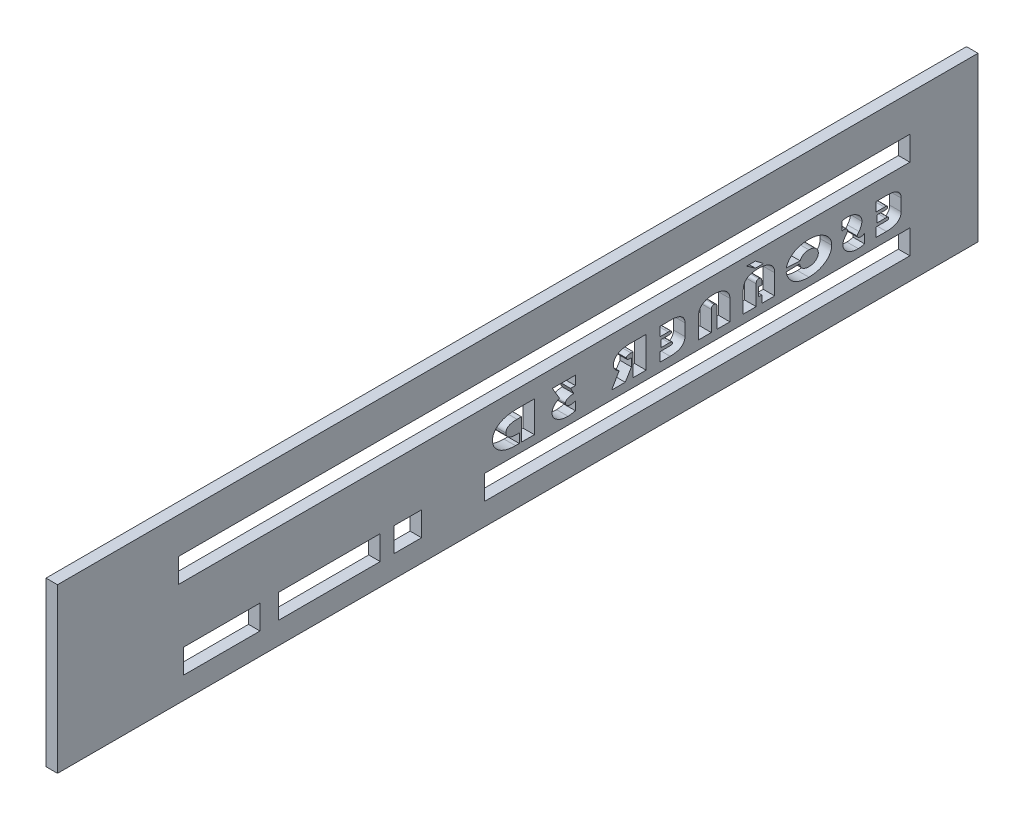
from build123d import *

# Parameters (mm, degrees)
CROQUIS1_W              = 400
CROQUIS1_H              = 71
SALIENTE_EXTRUIR1_DEPTH = 5
CROQUIS2_W              = 12.02046203
CROQUIS2_H              = 10.51923992
CROQUIS2_W_2            = 317.814316247
CROQUIS2_W_3            = 44.192239782
CROQUIS2_W_4            = 33.208558697
CROQUIS2_W_5            = 184.761089321
CORTAR_EXTRUIR1_DEPTH   = 10


with BuildPart() as part:
    # Croquis1 → Saliente-Extruir1 (new body)
    with BuildSketch(Plane(origin=(0, 0, 0), x_dir=(0, 0, -1), z_dir=(1, 0, 0))):
        with Locations((59.75308642, 0)):
            Rectangle(CROQUIS1_W, CROQUIS1_H)
    extrude(amount=SALIENTE_EXTRUIR1_DEPTH)

    # Croquis2 → Cortar-Extruir1 (cut)
    with BuildSketch(Plane(origin=(5, 0, 0), x_dir=(0, 0, -1), z_dir=(1, 0, 0))):
        with Locations((11.933317435, -20.65961996)):
            Rectangle(CROQUIS2_W, CROQUIS2_H)
        with Locations((71.235692244, 14.574525503)):
            Rectangle(CROQUIS2_W_2, CROQUIS2_H)
        with Locations((-22.096119891, -20.65961996)):
            Rectangle(CROQUIS2_W_3, CROQUIS2_H)
        with Locations((-68.854478227, -20.65961996)):
            Rectangle(CROQUIS2_W_4, CROQUIS2_H)
        with Locations((137.762305707, -20.65961996)):
            Rectangle(CROQUIS2_W_5, CROQUIS2_H)
        with BuildLine():
            Line((215.855840659, -3.401664255), (215.855840659, -6.401664255))
            Line((215.855840659, -6.401664255), (219.541387534, -6.401664255))
            add(Edge.make_bspline(
                [(219.541387534, -6.401664255), (219.657673329, -6.402754075), (219.872134465, -6.404763986), (220.166200824, -6.433364173), (220.406325417, -6.478238671), (220.597814798, -6.539963575), (220.744643924, -6.629511988), (220.845477967, -6.749235234), (220.908363541, -6.895113914), (220.914887688, -7.001570842), (220.918340659, -7.057914255)],
                knots=[0, 0, 0, 0, 1.630136716, 3.006394509, 4.137064202, 5.050894287, 5.814465357, 6.514080752, 7.213562109, 8, 8, 8, 8], degree=3))
            add(Edge.make_bspline(
                [(220.918340659, -7.057914255), (220.914908071, -7.120018847), (220.908508946, -7.235795929), (220.848019717, -7.394257007), (220.74421513, -7.519004013), (220.586104232, -7.601138101), (220.372400147, -7.653572255), (220.085292913, -7.687630043), (219.71653488, -7.709747805), (219.44279667, -7.712597957), (219.292364097, -7.714164255)],
                knots=[0, 0, 0, 0, 0.750752499, 1.39957338, 2.021345761, 2.673616694, 3.521257015, 4.68037925, 6.175705575, 8, 8, 8, 8], degree=3))
            Line((219.292364097, -7.714164255), (215.480840659, -7.714164255))
            Line((215.480840659, -7.714164255), (215.480840659, -11.651664255))
            Line((215.480840659, -11.651664255), (219.931035972, -11.651664255))
            add(Edge.make_bspline(
                [(219.931035972, -11.651664255), (220.184042476, -11.648202173), (220.674942092, -11.641484817), (221.388068473, -11.59230836), (222.054124524, -11.50761771), (222.675148107, -11.392033278), (223.251300704, -11.240228636), (223.781955025, -11.054209422), (224.266279681, -10.833300519), (224.704510959, -10.582603021), (225.094596007, -10.29849976), (225.430848412, -9.979271446), (225.718511458, -9.632298878), (225.951435929, -9.252945781), (226.135123312, -8.845739567), (226.264053481, -8.407186373), (226.340852121, -7.938550904), (226.350763198, -7.615825254), (226.355840659, -7.45049238)],
                knots=[0, 0, 0, 0, 1.403479464, 2.72312182, 3.962863154, 5.12629019, 6.224831384, 7.264870769, 8.241819425, 9.17381455, 10.061224736, 10.911944124, 11.739457619, 12.554319661, 13.373904124, 14.210359775, 15.083164408, 16, 16, 16, 16], degree=3))
            Line((226.355840659, -7.45049238), (226.355840659, -2.276664255))
            add(Edge.make_bspline(
                [(226.355840659, -2.276664255), (226.351811969, -2.117192202), (226.343956203, -1.806228892), (226.268890773, -1.353595597), (226.145246503, -0.929011636), (225.975682954, -0.529939965), (225.752800272, -0.160136739), (225.481606327, 0.181104819), (225.161166576, 0.494132434), (224.794336523, 0.777825663), (224.381967137, 1.029556436), (223.92909071, 1.248566579), (223.438283144, 1.436399433), (222.907966138, 1.588612872), (222.337546497, 1.704012287), (221.728067896, 1.788670154), (221.078339756, 1.83815436), (220.632293595, 1.844876097), (220.402715659, 1.848335745)],
                knots=[0, 0, 0, 0, 0.937519619, 1.828120967, 2.689831853, 3.533917632, 4.371350085, 5.221881962, 6.091218756, 7.000159233, 7.944046288, 8.928075012, 9.955484324, 11.031822199, 12.169744694, 13.376208322, 14.649546329, 16, 16, 16, 16], degree=3))
            Line((220.402715659, 1.848335745), (215.480840659, 1.848335745))
            Line((215.480840659, 1.848335745), (215.480840659, -2.089164255))
            Line((215.480840659, -2.089164255), (219.096075034, -2.089164255))
            add(Edge.make_bspline(
                [(219.096075034, -2.089164255), (219.209478981, -2.0899219), (219.421201757, -2.091336409), (219.715843209, -2.12511742), (219.966433189, -2.171031646), (220.173186419, -2.241368743), (220.337478928, -2.329082612), (220.457668337, -2.442092115), (220.529838984, -2.580033947), (220.538808303, -2.680166875), (220.543340659, -2.730765817)],
                knots=[0, 0, 0, 0, 1.560937436, 2.914237275, 4.080289261, 5.063011804, 5.912291937, 6.625747919, 7.305566083, 8, 8, 8, 8], degree=3))
            add(Edge.make_bspline(
                [(220.543340659, -2.730765817), (220.540751475, -2.790329093), (220.535842175, -2.903265842), (220.461303241, -3.053895759), (220.351570541, -3.178968355), (220.187667219, -3.266491979), (219.973070973, -3.330414891), (219.696707789, -3.368330094), (219.355557945, -3.399207835), (219.105946448, -3.400798535), (218.970098472, -3.401664255)],
                knots=[0, 0, 0, 0, 0.740721677, 1.404467702, 2.064351403, 2.800491568, 3.700239067, 4.867468387, 6.295158338, 8, 8, 8, 8], degree=3))
            Line((218.970098472, -3.401664255), (215.855840659, -3.401664255))
        make_face()
        with BuildLine():
            Line((200.668340659, 1.906929495), (200.668340659, -1.863578317))
            add(Edge.make_bspline(
                [(200.668340659, -1.863578317), (200.761929989, -1.841313009), (200.936775902, -1.799716408), (201.183994353, -1.752914009), (201.396956227, -1.720026548), (201.528599374, -1.715992542), (201.588262534, -1.714164255)],
                knots=[0, 0, 0, 0, 1.235918481, 2.308973649, 3.233594919, 4, 4, 4, 4], degree=3))
            add(Edge.make_bspline(
                [(201.588262534, -1.714164255), (201.689256232, -1.717513403), (201.885644539, -1.724026024), (202.168228843, -1.791910359), (202.429931211, -1.89662868), (202.661363319, -2.044957576), (202.855062861, -2.221666906), (203.001514611, -2.420052421), (203.088146633, -2.642145463), (203.099906765, -2.796457942), (203.105840659, -2.874320505)],
                knots=[0, 0, 0, 0, 1.145792027, 2.228061382, 3.283303588, 4.336267092, 5.333721328, 6.248463591, 7.116214617, 8, 8, 8, 8], degree=3))
            add(Edge.make_bspline(
                [(203.105840659, -2.874320505), (203.098178461, -2.948241492), (203.081465681, -3.109477887), (202.981512448, -3.359138813), (202.822345074, -3.631653625), (202.686932746, -3.815090869), (202.613653159, -3.914359567)],
                knots=[0, 0, 0, 0, 0.760632877, 1.659091795, 2.733196679, 4, 4, 4, 4], degree=3))
            Line((202.613653159, -3.914359567), (202.191778159, -4.453422067))
            add(Edge.make_bspline(
                [(202.191778159, -4.453422067), (202.100403854, -4.573409166), (201.92219693, -4.807419498), (201.687157708, -5.168057915), (201.489950604, -5.526786137), (201.327548141, -5.88202701), (201.200630956, -6.234738651), (201.108838433, -6.583469055), (201.053705755, -6.930170594), (201.046783712, -7.160262464), (201.043340659, -7.27471113)],
                knots=[0, 0, 0, 0, 1.166174929, 2.27438605, 3.325643325, 4.329518438, 5.292291421, 6.221076418, 7.115155916, 8, 8, 8, 8], degree=3))
            add(Edge.make_bspline(
                [(201.043340659, -7.27471113), (201.048240929, -7.438295689), (201.057920483, -7.761426009), (201.157324662, -8.234782243), (201.309504949, -8.688715387), (201.521932365, -9.124714138), (201.802255465, -9.535927354), (202.138826114, -9.931094441), (202.537011053, -10.306620251), (202.991420591, -10.657078744), (203.489155496, -10.976145966), (204.017552314, -11.258818426), (204.573430063, -11.496674615), (205.156876906, -11.689942343), (205.765949074, -11.842250788), (206.402509069, -11.950184718), (207.065375943, -12.016004796), (207.516819284, -12.023070152), (207.746465659, -12.026664255)],
                knots=[0, 0, 0, 0, 0.862895045, 1.704485763, 2.542846037, 3.387103593, 4.256861803, 5.164282421, 6.123812978, 7.142095967, 8.190804431, 9.242995114, 10.303571725, 11.380057313, 12.485896787, 13.616207831, 14.787379987, 16, 16, 16, 16], degree=3))
            add(Edge.make_bspline(
                [(207.746465659, -12.026664255), (207.971401124, -12.021319585), (208.42115531, -12.010633018), (209.093500904, -11.914555573), (209.762773595, -11.765113256), (210.198788618, -11.617563415), (210.418340659, -11.543265817)],
                knots=[0, 0, 0, 0, 0.988734236, 1.976955317, 2.98131127, 4, 4, 4, 4], degree=3))
            Line((210.418340659, -11.543265817), (210.418340659, -7.605765817))
            add(Edge.make_bspline(
                [(210.418340659, -7.605765817), (210.287959366, -7.679073343), (210.039843486, -7.818577721), (209.664457218, -7.970720487), (209.311227562, -8.070896342), (209.081028311, -8.083259207), (208.971075034, -8.089164255)],
                knots=[0, 0, 0, 0, 1.162224486, 2.211715691, 3.145836845, 4, 4, 4, 4], degree=3))
            add(Edge.make_bspline(
                [(208.971075034, -8.089164255), (208.851736564, -8.084997861), (208.622421363, -8.076991916), (208.292523673, -8.022411589), (207.994997765, -7.924959871), (207.731858652, -7.795758987), (207.512516305, -7.636465477), (207.349354147, -7.451990588), (207.249511493, -7.2405793), (207.237120398, -7.092131273), (207.230840659, -7.01689863)],
                knots=[0, 0, 0, 0, 1.272270679, 2.444735607, 3.550984775, 4.598604102, 5.558537262, 6.42242629, 7.200494327, 8, 8, 8, 8], degree=3))
            add(Edge.make_bspline(
                [(207.230840659, -7.01689863), (207.233586374, -6.988314184), (207.240010353, -6.921436904), (207.283967603, -6.813553798), (207.344208234, -6.681468905), (207.434236081, -6.530178878), (207.547411712, -6.356572507), (207.680663138, -6.157439089), (207.842565843, -5.938043494), (207.961823722, -5.78704699), (208.024785972, -5.707328317)],
                knots=[0, 0, 0, 0, 0.443987436, 1.038770286, 1.791912179, 2.702396897, 3.766744256, 5.011861415, 6.422410889, 8, 8, 8, 8], degree=3))
            add(Edge.make_bspline(
                [(208.024785972, -5.707328317), (208.125310327, -5.574875486), (208.322001773, -5.315711038), (208.578562875, -4.913181582), (208.801932827, -4.513909667), (208.981064029, -4.111775386), (209.119298876, -3.708547701), (209.219874202, -3.306954543), (209.280766372, -2.904501821), (209.289152121, -2.636241599), (209.293340659, -2.502250192)],
                knots=[0, 0, 0, 0, 1.135703392, 2.222179327, 3.258486084, 4.259143465, 5.225578612, 6.167446175, 7.084670609, 8, 8, 8, 8], degree=3))
            add(Edge.make_bspline(
                [(209.293340659, -2.502250192), (209.287780078, -2.343645035), (209.27674346, -2.028846219), (209.186202348, -1.566624314), (209.037945775, -1.121847033), (208.831143691, -0.694547941), (208.56390998, -0.283743036), (208.237313796, 0.108229494), (207.851802921, 0.482164928), (207.415861845, 0.835028084), (206.939847617, 1.161422238), (206.432125142, 1.444998637), (205.903055544, 1.686211067), (205.351561069, 1.883956733), (204.776986596, 2.035754297), (204.179261729, 2.142619951), (203.559703389, 2.213679626), (203.138269175, 2.220083084), (202.924200034, 2.223335745)],
                knots=[0, 0, 0, 0, 0.868592718, 1.723978994, 2.57012504, 3.431782609, 4.317952458, 5.249128397, 6.221703252, 7.25641221, 8.319193202, 9.380599018, 10.439113855, 11.50213734, 12.587317582, 13.69156897, 14.827423522, 16, 16, 16, 16], degree=3))
            add(Edge.make_bspline(
                [(202.924200034, 2.223335745), (202.733626462, 2.219132482), (202.352574444, 2.210728052), (201.784629554, 2.150867022), (201.221597758, 2.051902761), (200.853302839, 1.955396241), (200.668340659, 1.906929495)],
                knots=[0, 0, 0, 0, 1.000793928, 2.001088306, 2.996122278, 4, 4, 4, 4], degree=3))
        make_face()
        with BuildLine():
            Line((182.264043784, -5.004203317), (176.390020347, -5.112601755))
            add(Edge.make_bspline(
                [(176.390020347, -5.112601755), (176.443265565, -5.381517776), (176.547900464, -5.909978384), (176.794153814, -6.668190725), (177.08962221, -7.38404875), (177.455891439, -8.050567069), (177.885816164, -8.668505043), (178.377750962, -9.239828183), (178.931861955, -9.763375319), (179.545192834, -10.238170401), (180.214758408, -10.660021851), (180.935852294, -11.026685768), (181.705961188, -11.338515796), (182.526621232, -11.587590927), (183.393374813, -11.788644984), (184.310133101, -11.927241694), (185.275232467, -12.009189065), (185.934779696, -12.020753823), (186.271856284, -12.026664255)],
                knots=[0, 0, 0, 0, 0.992752036, 1.950907732, 2.883657513, 3.796033148, 4.701268786, 5.607258288, 6.523579586, 7.459493467, 8.41392897, 9.387402432, 10.387721803, 11.42103917, 12.492517806, 13.609777017, 14.778422268, 16, 16, 16, 16], degree=3))
            add(Edge.make_bspline(
                [(186.271856284, -12.026664255), (186.615802522, -12.02033671), (187.291330284, -12.007909092), (188.28350772, -11.914305683), (189.232856015, -11.752366932), (190.140031823, -11.530618435), (191.004975857, -11.246863272), (191.825696269, -10.897510358), (192.602732968, -10.482292531), (193.212599024, -10.085256334), (193.671478008, -9.740419141), (193.993143793, -9.474530048), (194.29370926, -9.201150841), (194.571222855, -8.920354802), (194.829184215, -8.632969201), (195.057849248, -8.33333619), (195.2723322, -8.030464559), (195.46160535, -7.717862132), (195.629029776, -7.397970239), (195.774703482, -7.070728174), (195.892427328, -6.734719718), (195.993998356, -6.391897116), (196.072774757, -6.041602667), (196.128647994, -5.682442345), (196.160874735, -5.316320926), (196.16584166, -5.069694313), (196.168340659, -4.945609567)],
                knots=[0, 0, 0, 0, 1.834350375, 3.602756677, 5.309376519, 6.96682563, 8.57937272, 10.159260752, 11.718188301, 13.272689149, 14.035240609, 14.778842387, 15.497810052, 16.201290444, 16.883866045, 17.555866511, 18.210442383, 18.862547482, 19.503236293, 20.135227566, 20.771155985, 21.400781772, 22.041449409, 22.684568482, 23.338169618, 24, 24, 24, 24], degree=3))
            add(Edge.make_bspline(
                [(196.168340659, -4.945609567), (196.165762756, -4.820559868), (196.160638819, -4.572006459), (196.129555067, -4.202646754), (196.069486088, -3.841964218), (195.989777709, -3.489025811), (195.89229205, -3.142145443), (195.76342691, -2.805126421), (195.618334176, -2.473283647), (195.447748259, -2.150305639), (195.25280425, -1.836634812), (195.03853893, -1.527969956), (194.802686527, -1.225927904), (194.537977005, -0.936649843), (194.259582284, -0.647970758), (193.951810948, -0.37299692), (193.623464075, -0.103147491), (193.156316034, 0.247369048), (192.533883029, 0.649808276), (191.745195127, 1.073810354), (190.910594253, 1.427861974), (190.036542997, 1.722317529), (189.118832055, 1.946726266), (188.161168397, 2.10669933), (187.161640768, 2.205771409), (186.481073266, 2.217405425), (186.134160972, 2.223335745)],
                knots=[0, 0, 0, 0, 0.658901174, 1.309656348, 1.950821784, 2.583675695, 3.215503928, 3.847206453, 4.482981758, 5.122803918, 5.76964204, 6.427618496, 7.101810357, 7.786753817, 8.492596906, 9.213873327, 9.959618948, 10.731392011, 12.289796147, 13.859675221, 15.443262943, 17.060544451, 18.713997068, 20.415021004, 22.172593778, 24, 24, 24, 24], degree=3))
            add(Edge.make_bspline(
                [(186.134160972, 2.223335745), (185.793114818, 2.217204213), (185.124348819, 2.205180736), (184.143572256, 2.109172438), (183.205130485, 1.955826597), (182.309404367, 1.736572683), (181.456979698, 1.451971379), (180.648855719, 1.104831666), (179.880206317, 0.699503216), (179.404756935, 0.375397006), (179.167364097, 0.21357012)],
                knots=[0, 0, 0, 0, 1.110237194, 2.177092093, 3.205293721, 4.203966652, 5.176269235, 6.127761153, 7.06518736, 8, 8, 8, 8], degree=3))
            add(Edge.make_bspline(
                [(179.167364097, 0.21357012), (179.009880593, 0.095180153), (178.695986315, -0.140793346), (178.265104069, -0.542672426), (177.869109536, -0.977289389), (177.506183939, -1.444107212), (177.184292319, -1.948967936), (176.893582007, -2.484625392), (176.640166628, -3.056338011), (176.501498373, -3.454318604), (176.431035972, -3.656547067)],
                knots=[0, 0, 0, 0, 0.979964789, 1.953254354, 2.926835098, 3.903818604, 4.891992314, 5.90319124, 6.93453495, 8, 8, 8, 8], degree=3))
            Line((176.431035972, -3.656547067), (182.442754722, -3.94658613))
            add(Edge.make_bspline(
                [(182.442754722, -3.94658613), (182.485520793, -3.856149717), (182.570187971, -3.677106014), (182.715899435, -3.422640989), (182.878394074, -3.187941678), (183.052113694, -2.968291871), (183.241349546, -2.767417125), (183.446045556, -2.58431347), (183.662683748, -2.416726592), (183.893732858, -2.267289208), (184.140435162, -2.13745657), (184.399957686, -2.024158549), (184.673437265, -1.9257753), (184.962395004, -1.851655351), (185.263326008, -1.789341773), (185.579413734, -1.74572202), (185.909085829, -1.719053252), (186.134109537, -1.715811185), (186.248418784, -1.714164255)],
                knots=[0, 0, 0, 0, 1.021460263, 2.022260972, 2.990527933, 3.934449091, 4.879897076, 5.80508482, 6.736701277, 7.6745433, 8.611483323, 9.580623128, 10.564836631, 11.576069066, 12.624489731, 13.702106345, 14.832698578, 16, 16, 16, 16], degree=3))
            add(Edge.make_bspline(
                [(186.248418784, -1.714164255), (186.393995814, -1.717266784), (186.679876712, -1.723359463), (187.098647036, -1.762564805), (187.496622825, -1.838021017), (187.876512531, -1.936120976), (188.236637927, -2.066001677), (188.579783077, -2.220068884), (188.898891256, -2.409580718), (189.197609119, -2.622388448), (189.468367461, -2.857023319), (189.704774612, -3.110701901), (189.90538798, -3.378707365), (190.072294648, -3.661578817), (190.197919226, -3.962828779), (190.288726657, -4.278317592), (190.34712754, -4.609469611), (190.3528985, -4.835986027), (190.355840659, -4.951468942)],
                knots=[0, 0, 0, 0, 1.196957228, 2.350557687, 3.452867449, 4.523946135, 5.572766527, 6.596707709, 7.611543077, 8.61859937, 9.608775799, 10.551803759, 11.463871259, 12.356183022, 13.244911698, 14.139315975, 15.051383475, 16, 16, 16, 16], degree=3))
            add(Edge.make_bspline(
                [(190.355840659, -4.951468942), (190.352581172, -5.063001604), (190.346195483, -5.281506212), (190.292249277, -5.602539301), (190.200775567, -5.906752889), (190.076717245, -6.198657108), (189.915183535, -6.474256057), (189.71529615, -6.733796218), (189.484170137, -6.98083885), (189.217077066, -7.207115578), (188.925417443, -7.414668325), (188.611110058, -7.597244614), (188.276187637, -7.749431744), (187.922713942, -7.8721218), (187.551465491, -7.96911634), (187.161749989, -8.039314402), (186.752231818, -8.080427848), (186.47312169, -8.086209083), (186.330450034, -8.089164255)],
                knots=[0, 0, 0, 0, 0.939860965, 1.841289795, 2.734750413, 3.612559575, 4.509200856, 5.419794395, 6.369163099, 7.355921635, 8.365631112, 9.383763894, 10.415355745, 11.462080506, 12.534426685, 13.647100621, 14.797277433, 16, 16, 16, 16], degree=3))
            add(Edge.make_bspline(
                [(186.330450034, -8.089164255), (186.186794365, -8.087314013), (185.905786039, -8.083694712), (185.495904689, -8.043825777), (185.107641294, -7.984563786), (184.742813304, -7.895133735), (184.398709468, -7.785721433), (184.07867079, -7.646840386), (183.78016779, -7.486150905), (183.50708505, -7.297376454), (183.257618057, -7.086600662), (183.033645843, -6.853997616), (182.835731315, -6.600109845), (182.664152918, -6.323802688), (182.526175826, -6.022985867), (182.406047703, -5.704988018), (182.318514254, -5.362863837), (182.282491487, -5.125672115), (182.264043784, -5.004203317)],
                knots=[0, 0, 0, 0, 1.217538849, 2.381657159, 3.488296945, 4.544575858, 5.563090521, 6.545879474, 7.498059416, 8.432764682, 9.355066706, 10.262684078, 11.165302853, 12.079804906, 13.013152414, 13.966699243, 14.958721679, 16, 16, 16, 16], degree=3))
        make_face()
        with BuildLine():
            Line((164.293340659, -4.714164255), (164.293340659, -8.464164255))
            Line((164.293340659, -8.464164255), (165.793340659, -8.464164255))
            Line((165.793340659, -8.464164255), (165.793340659, -11.651664255))
            Line((165.793340659, -11.651664255), (171.418340659, -11.651664255))
            Line((171.418340659, -11.651664255), (171.418340659, -2.953422067))
            add(Edge.make_bspline(
                [(171.418340659, -2.953422067), (171.412989491, -2.753867939), (171.402546932, -2.364447294), (171.312950198, -1.796936869), (171.164717121, -1.264331246), (170.953609922, -0.767430629), (170.688530178, -0.302509678), (170.361772642, 0.128219237), (169.969520936, 0.51802573), (169.526001071, 0.877295427), (169.027238171, 1.195371404), (168.477922195, 1.471245782), (167.881733605, 1.705600849), (167.237063907, 1.894238209), (166.546034547, 2.044466854), (165.806539275, 2.146623357), (165.020154523, 2.213315646), (164.48000912, 2.219935123), (164.202520347, 2.223335745)],
                knots=[0, 0, 0, 0, 0.955562247, 1.864735494, 2.744519502, 3.597818857, 4.444474242, 5.302531524, 6.179212579, 7.087434361, 8.032227191, 9.007245044, 10.028072126, 11.096843119, 12.221886398, 13.412840862, 14.670899338, 16, 16, 16, 16], degree=3))
            add(Edge.make_bspline(
                [(164.202520347, 2.223335745), (163.935830445, 2.219106258), (163.420399996, 2.210931946), (162.673694823, 2.156672303), (161.980784092, 2.060577098), (161.341031382, 1.927306352), (160.753634512, 1.756260562), (160.22199132, 1.541016457), (159.7393642, 1.294522479), (159.314145817, 1.000696629), (158.936399239, 0.670989771), (158.612414613, 0.295427276), (158.337887586, -0.121189062), (158.113817426, -0.580008608), (157.941345054, -1.081087508), (157.820772208, -1.623644725), (157.741381933, -2.206943339), (157.734429915, -2.610370931), (157.730840659, -2.818656442)],
                knots=[0, 0, 0, 0, 1.360932961, 2.630269395, 3.817809215, 4.928126888, 5.962504934, 6.935110729, 7.851228201, 8.722080596, 9.565935801, 10.403231988, 11.244980296, 12.10527408, 13.002034629, 13.942576911, 14.937773642, 16, 16, 16, 16], degree=3))
            Line((157.730840659, -2.818656442), (157.730840659, -11.651664255))
            Line((157.730840659, -11.651664255), (163.355840659, -11.651664255))
            Line((163.355840659, -11.651664255), (163.355840659, -3.07939863))
            add(Edge.make_bspline(
                [(163.355840659, -3.07939863), (163.357622103, -2.961018754), (163.360924677, -2.741557345), (163.409471873, -2.442623263), (163.486051895, -2.19960463), (163.599978695, -2.008030201), (163.763804706, -1.868431983), (163.974822519, -1.775259656), (164.233076695, -1.72176008), (164.420993912, -1.716817257), (164.521856284, -1.714164255)],
                knots=[0, 0, 0, 0, 1.349596285, 2.50198187, 3.442922759, 4.243831801, 5.010191558, 5.857808669, 6.850203806, 8, 8, 8, 8], degree=3))
            add(Edge.make_bspline(
                [(164.521856284, -1.714164255), (164.621824999, -1.717373336), (164.810487007, -1.723429547), (165.074559878, -1.787450895), (165.296565746, -1.898289266), (165.483752799, -2.048416632), (165.625386653, -2.24759339), (165.725598678, -2.488678713), (165.782476327, -2.771130473), (165.789579857, -2.972688379), (165.793340659, -3.07939863)],
                knots=[0, 0, 0, 0, 1.121363497, 2.11624895, 3.023677973, 3.888757511, 4.783839986, 5.737232887, 6.802029397, 8, 8, 8, 8], degree=3))
            Line((165.793340659, -3.07939863), (165.793340659, -4.714164255))
            Line((165.793340659, -4.714164255), (164.293340659, -4.714164255))
        make_face()
        Polygon((159.189825034, 5.67450762), (163.048223472, 2.973335745), (166.490606284, 2.973335745), (163.048223472, 5.67450762), align=None)
        with BuildLine():
            Line((151.918340659, -11.651664255), (151.918340659, -2.82158613))
            add(Edge.make_bspline(
                [(151.918340659, -2.82158613), (151.913176875, -2.634682021), (151.903055198, -2.268326152), (151.809778061, -1.733790234), (151.656903211, -1.229190754), (151.444204371, -0.7521598), (151.169364561, -0.305007315), (150.835365917, 0.114519393), (150.439007733, 0.502805934), (149.984641529, 0.85801957), (149.481014254, 1.178940568), (148.935665953, 1.461647498), (148.347216103, 1.693977785), (147.722750725, 1.892956971), (147.055319167, 2.038916854), (146.350004915, 2.147763521), (145.604139389, 2.212862945), (145.093275681, 2.219786829), (144.831426597, 2.223335745)],
                knots=[0, 0, 0, 0, 0.920413059, 1.804126881, 2.664241702, 3.512972747, 4.370498886, 5.243813309, 6.148991121, 7.09823984, 8.080755947, 9.088038995, 10.120179025, 11.194718592, 12.314347231, 13.482949882, 14.709856936, 16, 16, 16, 16], degree=3))
            add(Edge.make_bspline(
                [(144.831426597, 2.223335745), (144.57247231, 2.220036327), (144.069336018, 2.213625709), (143.337805942, 2.145819911), (142.651800091, 2.047379656), (142.012494652, 1.901433107), (141.42228158, 1.710009002), (140.87581084, 1.483294086), (140.378264261, 1.209450769), (139.927959581, 0.895646177), (139.526541726, 0.54304636), (139.178306116, 0.15190203), (138.88609258, -0.278454173), (138.643777481, -0.74273226), (138.460010734, -1.246723165), (138.324699205, -1.78439876), (138.245079636, -2.360225097), (138.235674708, -2.755905347), (138.230840659, -2.959281442)],
                knots=[0, 0, 0, 0, 1.303555738, 2.532748956, 3.696212003, 4.791239296, 5.830025681, 6.817289634, 7.765843729, 8.683930017, 9.575804656, 10.450114009, 11.313471885, 12.188817747, 13.0803263, 14.008197646, 14.976231478, 16, 16, 16, 16], degree=3))
            Line((138.230840659, -2.959281442), (138.230840659, -11.651664255))
            Line((138.230840659, -11.651664255), (143.855840659, -11.651664255))
            Line((143.855840659, -11.651664255), (143.855840659, -2.959281442))
            add(Edge.make_bspline(
                [(143.855840659, -2.959281442), (143.859785643, -2.861355523), (143.867196644, -2.677393024), (143.921388343, -2.419240844), (144.018510885, -2.198902997), (144.158970367, -2.019241939), (144.338877508, -1.879004931), (144.558388696, -1.783450228), (144.81471833, -1.724655538), (144.998069276, -1.7177949), (145.095098472, -1.714164255)],
                knots=[0, 0, 0, 0, 1.167136709, 2.192569502, 3.125308558, 4.012691332, 4.883731052, 5.816470108, 6.844477461, 8, 8, 8, 8], degree=3))
            add(Edge.make_bspline(
                [(145.095098472, -1.714164255), (145.189178483, -1.717818746), (145.366705089, -1.724714678), (145.614844561, -1.783013017), (145.825914039, -1.881015655), (146.002540999, -2.017516968), (146.133193284, -2.20128314), (146.226545684, -2.420022419), (146.28678336, -2.676827459), (146.291064898, -2.861253589), (146.293340659, -2.959281442)],
                knots=[0, 0, 0, 0, 1.13973307, 2.15064754, 3.066989544, 3.94352748, 4.824532694, 5.768310729, 6.813792231, 8, 8, 8, 8], degree=3))
            Line((146.293340659, -2.959281442), (146.293340659, -11.651664255))
            Line((146.293340659, -11.651664255), (151.918340659, -11.651664255))
        make_face()
        with BuildLine():
            Line((121.918340659, -3.401664255), (121.918340659, -6.401664255))
            Line((121.918340659, -6.401664255), (125.603887534, -6.401664255))
            add(Edge.make_bspline(
                [(125.603887534, -6.401664255), (125.720173329, -6.402754075), (125.934634465, -6.404763986), (126.228700824, -6.433364173), (126.468825417, -6.478238671), (126.660314798, -6.539963575), (126.807143924, -6.629511988), (126.907977967, -6.749235234), (126.970863541, -6.895113914), (126.977387688, -7.001570842), (126.980840659, -7.057914255)],
                knots=[0, 0, 0, 0, 1.630136716, 3.006394509, 4.137064202, 5.050894287, 5.814465357, 6.514080752, 7.213562109, 8, 8, 8, 8], degree=3))
            add(Edge.make_bspline(
                [(126.980840659, -7.057914255), (126.977408071, -7.120018847), (126.971008946, -7.235795929), (126.910519717, -7.394257007), (126.80671513, -7.519004013), (126.648604232, -7.601138101), (126.434900147, -7.653572255), (126.147792913, -7.687630043), (125.77903488, -7.709747805), (125.50529667, -7.712597957), (125.354864097, -7.714164255)],
                knots=[0, 0, 0, 0, 0.750752499, 1.39957338, 2.021345761, 2.673616694, 3.521257015, 4.68037925, 6.175705575, 8, 8, 8, 8], degree=3))
            Line((125.354864097, -7.714164255), (121.543340659, -7.714164255))
            Line((121.543340659, -7.714164255), (121.543340659, -11.651664255))
            Line((121.543340659, -11.651664255), (125.993535972, -11.651664255))
            add(Edge.make_bspline(
                [(125.993535972, -11.651664255), (126.246542476, -11.648202173), (126.737442092, -11.641484817), (127.450568473, -11.59230836), (128.116624524, -11.50761771), (128.737648107, -11.392033278), (129.313800704, -11.240228636), (129.844455025, -11.054209422), (130.328779681, -10.833300519), (130.767010959, -10.582603021), (131.157096007, -10.29849976), (131.493348412, -9.979271446), (131.781011458, -9.632298878), (132.013935929, -9.252945781), (132.197623312, -8.845739567), (132.326553481, -8.407186373), (132.403352121, -7.938550904), (132.413263198, -7.615825254), (132.418340659, -7.45049238)],
                knots=[0, 0, 0, 0, 1.403479464, 2.72312182, 3.962863154, 5.12629019, 6.224831384, 7.264870769, 8.241819425, 9.17381455, 10.061224736, 10.911944124, 11.739457619, 12.554319661, 13.373904124, 14.210359775, 15.083164408, 16, 16, 16, 16], degree=3))
            Line((132.418340659, -7.45049238), (132.418340659, -2.276664255))
            add(Edge.make_bspline(
                [(132.418340659, -2.276664255), (132.414311969, -2.117192202), (132.406456203, -1.806228892), (132.331390773, -1.353595597), (132.207746503, -0.929011636), (132.038182954, -0.529939965), (131.815300272, -0.160136739), (131.544106327, 0.181104819), (131.223666576, 0.494132434), (130.856836523, 0.777825663), (130.444467137, 1.029556436), (129.99159071, 1.248566579), (129.500783144, 1.436399433), (128.970466138, 1.588612872), (128.400046497, 1.704012287), (127.790567896, 1.788670154), (127.140839756, 1.83815436), (126.694793595, 1.844876097), (126.465215659, 1.848335745)],
                knots=[0, 0, 0, 0, 0.937519619, 1.828120967, 2.689831853, 3.533917632, 4.371350085, 5.221881962, 6.091218756, 7.000159233, 7.944046288, 8.928075012, 9.955484324, 11.031822199, 12.169744694, 13.376208322, 14.649546329, 16, 16, 16, 16], degree=3))
            Line((126.465215659, 1.848335745), (121.543340659, 1.848335745))
            Line((121.543340659, 1.848335745), (121.543340659, -2.089164255))
            Line((121.543340659, -2.089164255), (125.158575034, -2.089164255))
            add(Edge.make_bspline(
                [(125.158575034, -2.089164255), (125.271978981, -2.0899219), (125.483701757, -2.091336409), (125.778343209, -2.12511742), (126.028933189, -2.171031646), (126.235686419, -2.241368743), (126.399978928, -2.329082612), (126.520168337, -2.442092115), (126.592338984, -2.580033947), (126.601308303, -2.680166875), (126.605840659, -2.730765817)],
                knots=[0, 0, 0, 0, 1.560937436, 2.914237275, 4.080289261, 5.063011804, 5.912291937, 6.625747919, 7.305566083, 8, 8, 8, 8], degree=3))
            add(Edge.make_bspline(
                [(126.605840659, -2.730765817), (126.603251475, -2.790329093), (126.598342175, -2.903265842), (126.523803241, -3.053895759), (126.414070541, -3.178968355), (126.250167219, -3.266491979), (126.035570973, -3.330414891), (125.759207789, -3.368330094), (125.418057945, -3.399207835), (125.168446448, -3.400798535), (125.032598472, -3.401664255)],
                knots=[0, 0, 0, 0, 0.740721677, 1.404467702, 2.064351403, 2.800491568, 3.700239067, 4.867468387, 6.295158338, 8, 8, 8, 8], degree=3))
            Line((125.032598472, -3.401664255), (121.918340659, -3.401664255))
        make_face()
        with BuildLine():
            Line((109.918340659, -1.901664255), (109.918340659, -11.651664255))
            Line((109.918340659, -11.651664255), (115.543340659, -11.651664255))
            Line((115.543340659, -11.651664255), (115.543340659, 1.848335745))
            Line((115.543340659, 1.848335745), (108.406621909, 1.848335745))
            add(Edge.make_bspline(
                [(108.406621909, 1.848335745), (108.139912463, 1.84544196), (107.621500459, 1.839817213), (106.867541711, 1.782616592), (106.160220996, 1.693262741), (105.498072024, 1.568691877), (104.882124232, 1.404983438), (104.311179781, 1.206526344), (103.785839057, 0.971554272), (103.465475063, 0.779214665), (103.308965659, 0.685249808)],
                knots=[0, 0, 0, 0, 1.20819234, 2.348403551, 3.423504133, 4.437043572, 5.398667195, 6.3082313, 7.173509774, 8, 8, 8, 8], degree=3))
            add(Edge.make_bspline(
                [(103.308965659, 0.685249808), (103.149348372, 0.577145096), (102.839479498, 0.367278822), (102.426977754, 0.008050664), (102.078515376, -0.374897127), (101.790421613, -0.777824477), (101.567819947, -1.204962965), (101.408502095, -1.653295879), (101.311781852, -2.125086074), (101.299551725, -2.44710926), (101.293340659, -2.61064863)],
                knots=[0, 0, 0, 0, 1.143930929, 2.22074059, 3.238803518, 4.212189769, 5.153669698, 6.089040419, 7.029519799, 8, 8, 8, 8], degree=3))
            add(Edge.make_bspline(
                [(101.293340659, -2.61064863), (101.300183593, -2.778362745), (101.313723529, -3.110214362), (101.437392384, -3.596257846), (101.636026412, -4.060040856), (101.912605179, -4.504534458), (102.270402481, -4.924510089), (102.700799321, -5.327635802), (103.21279511, -5.706761813), (103.591894354, -5.930557295), (103.789434409, -6.047172067)],
                knots=[0, 0, 0, 0, 0.900224031, 1.781250193, 2.677301668, 3.603758406, 4.583695618, 5.634674607, 6.76748235, 8, 8, 8, 8], degree=3))
            Line((103.789434409, -6.047172067), (100.555059409, -11.651664255))
            Line((100.555059409, -11.651664255), (106.443731284, -11.651664255))
            Line((106.443731284, -11.651664255), (109.168340659, -7.271781442))
            Line((109.168340659, -7.271781442), (109.168340659, -3.776664255))
            Line((109.168340659, -3.776664255), (108.725957847, -3.776664255))
            add(Edge.make_bspline(
                [(108.725957847, -3.776664255), (108.584223628, -3.774483966), (108.319381038, -3.770409909), (107.94963115, -3.724961769), (107.636221745, -3.647236889), (107.375321939, -3.542199759), (107.171633938, -3.399166781), (107.023530248, -3.223537709), (106.933708988, -3.011909594), (106.923588766, -2.859570133), (106.918340659, -2.780570505)],
                knots=[0, 0, 0, 0, 1.472570212, 2.751624222, 3.861837232, 4.821392814, 5.657921365, 6.422047197, 7.181711139, 8, 8, 8, 8], degree=3))
            add(Edge.make_bspline(
                [(106.918340659, -2.780570505), (106.924164959, -2.71093052), (106.935689865, -2.573129514), (107.042749243, -2.38346466), (107.215318002, -2.228924008), (107.452178659, -2.107878659), (107.748880442, -2.012818454), (108.109471719, -1.949456451), (108.533633026, -1.909047666), (108.838151293, -1.904240505), (109.001348472, -1.901664255)],
                knots=[0, 0, 0, 0, 0.66972182, 1.325220583, 2.047500869, 2.88479652, 3.880077099, 5.053468571, 6.420897303, 8, 8, 8, 8], degree=3))
            Line((109.001348472, -1.901664255), (109.918340659, -1.901664255))
        make_face()
        with BuildLine():
            Line((84.793340659, 1.848335745), (74.797246909, 1.848335745))
            Line((74.797246909, 1.848335745), (77.882207847, -3.378226755))
            add(Edge.make_bspline(
                [(77.882207847, -3.378226755), (77.745873317, -3.444437528), (77.480176032, -3.573473239), (77.101694139, -3.781592589), (76.753115422, -3.996783476), (76.429548502, -4.210766804), (76.13938258, -4.435874425), (75.87390401, -4.660121818), (75.638500615, -4.891958836), (75.432395651, -5.130492074), (75.251234823, -5.37579762), (75.095186772, -5.63162936), (74.964002933, -5.898697147), (74.852675669, -6.175973717), (74.773724272, -6.466686883), (74.710047434, -6.765567239), (74.674947465, -7.076605488), (74.670572594, -7.287325123), (74.668340659, -7.394828317)],
                knots=[0, 0, 0, 0, 1.32951903, 2.591050102, 3.787113503, 4.922930344, 5.992207261, 7.006963288, 7.970213243, 8.887403723, 9.769885962, 10.642666624, 11.512414448, 12.377889964, 13.259331908, 14.151533636, 15.056964777, 16, 16, 16, 16], degree=3))
            add(Edge.make_bspline(
                [(74.668340659, -7.394828317), (74.674597144, -7.55447942), (74.686989757, -7.8707104), (74.78422933, -8.334130735), (74.940326227, -8.779226284), (75.162802458, -9.203403779), (75.448149102, -9.607374717), (75.793274707, -9.993681155), (76.204990419, -10.3562328), (76.669666319, -10.698321412), (77.180312026, -11.010047939), (77.725192687, -11.28264685), (78.300481017, -11.510597567), (78.901823652, -11.702487257), (79.533849328, -11.848866508), (80.195178446, -11.948436758), (80.884697854, -12.016537924), (81.354693051, -12.023246643), (81.594121909, -12.026664255)],
                knots=[0, 0, 0, 0, 0.832256108, 1.648502011, 2.458940759, 3.28605147, 4.138258985, 5.033026665, 5.981944626, 6.994720039, 8.039655831, 9.099033112, 10.168940805, 11.264506873, 12.389004719, 13.549002302, 14.751392385, 16, 16, 16, 16], degree=3))
            add(Edge.make_bspline(
                [(81.594121909, -12.026664255), (81.862975672, -12.021468509), (82.400265701, -12.011085087), (83.203322715, -11.913075061), (84.00493865, -11.772709718), (84.529722761, -11.625835215), (84.793340659, -11.55205488)],
                knots=[0, 0, 0, 0, 0.993773571, 1.986003938, 2.988297478, 4, 4, 4, 4], degree=3))
            Line((84.793340659, -11.55205488), (84.793340659, -7.749320505))
            add(Edge.make_bspline(
                [(84.793340659, -7.749320505), (84.603252017, -7.830070562), (84.241876021, -7.983583848), (83.705018792, -8.147162332), (83.207912198, -8.256271166), (82.886605802, -8.270090722), (82.733770347, -8.276664255)],
                knots=[0, 0, 0, 0, 1.157110786, 2.199774043, 3.14368853, 4, 4, 4, 4], degree=3))
            add(Edge.make_bspline(
                [(82.733770347, -8.276664255), (82.581006786, -8.270275921), (82.284357396, -8.257870505), (81.857517017, -8.167706896), (81.470952107, -8.009704839), (81.182805147, -7.830370031), (80.978760592, -7.663194095), (80.846650065, -7.52813682), (80.733841225, -7.385698851), (80.63931088, -7.23744338), (80.56774862, -7.079428205), (80.519525819, -6.914510765), (80.483939076, -6.743014829), (80.481885093, -6.625488114), (80.480840659, -6.565726755)],
                knots=[0, 0, 0, 0, 1.750525936, 3.39932147, 4.970766713, 6.51441864, 7.269712202, 7.990022416, 8.675300352, 9.349239933, 10.000487771, 10.655572153, 11.316369589, 12, 12, 12, 12], degree=3))
            add(Edge.make_bspline(
                [(80.480840659, -6.565726755), (80.48332845, -6.498046688), (80.488258389, -6.363928235), (80.537658384, -6.169256646), (80.614419663, -5.98381231), (80.724647713, -5.810714865), (80.863966024, -5.647147559), (81.037002735, -5.498721913), (81.23703841, -5.356534385), (81.469277274, -5.230063707), (81.72440447, -5.113282354), (82.00355639, -5.014501661), (82.301226817, -4.925785471), (82.621514898, -4.856119253), (82.962190517, -4.804429234), (83.32390541, -4.766550238), (83.706119319, -4.743061036), (83.96811165, -4.739447506), (84.101934409, -4.737601755)],
                knots=[0, 0, 0, 0, 0.727687647, 1.442024908, 2.149201493, 2.881738424, 3.642722404, 4.455111114, 5.330624105, 6.281788651, 7.298564145, 8.350005047, 9.46834729, 10.642339966, 11.87710199, 13.178098056, 14.558603967, 16, 16, 16, 16], degree=3))
            Line((84.101934409, -4.737601755), (82.704473472, -2.089164255))
            Line((82.704473472, -2.089164255), (84.793340659, -2.089164255))
            Line((84.793340659, -2.089164255), (84.793340659, 1.848335745))
        make_face()
        with BuildLine():
            Line((61.355840659, -2.089164255), (61.355840659, -11.651664255))
            Line((61.355840659, -11.651664255), (66.980840659, -11.651664255))
            Line((66.980840659, -11.651664255), (66.980840659, 1.848335745))
            Line((66.980840659, 1.848335745), (59.630254722, 1.848335745))
            add(Edge.make_bspline(
                [(59.630254722, 1.848335745), (59.237565051, 1.844272045), (58.473921908, 1.836369579), (57.361058588, 1.762751931), (56.314232068, 1.639054648), (55.330641266, 1.476878566), (54.414003079, 1.255900983), (53.561571963, 0.990413966), (52.77222491, 0.678433425), (52.285425152, 0.421027097), (52.048223472, 0.29560137)],
                knots=[0, 0, 0, 0, 1.204937942, 2.343180035, 3.420403369, 4.438747939, 5.40037327, 6.311217217, 7.177111108, 8, 8, 8, 8], degree=3))
            add(Edge.make_bspline(
                [(52.048223472, 0.29560137), (51.915288341, 0.218235687), (51.65471531, 0.066587209), (51.288562974, -0.186950184), (50.941374641, -0.440872666), (50.625290341, -0.713333314), (50.330280705, -0.990466122), (50.063954547, -1.281078895), (49.822135538, -1.58143668), (49.605143168, -1.891350062), (49.413900692, -2.212835957), (49.245808998, -2.543998217), (49.105634543, -2.887169304), (48.990712284, -3.239616193), (48.903217277, -3.602272046), (48.838271939, -3.974951129), (48.799377141, -4.358836916), (48.795364982, -4.618372594), (48.793340659, -4.749320505)],
                knots=[0, 0, 0, 0, 1.167522901, 2.288522061, 3.380142349, 4.432255617, 5.455135218, 6.452342446, 7.422887079, 8.381573108, 9.32271701, 10.261286278, 11.199122827, 12.134845939, 13.073737422, 14.02957966, 15.005830603, 16, 16, 16, 16], degree=3))
            add(Edge.make_bspline(
                [(48.793340659, -4.749320505), (48.795697715, -4.875373604), (48.800346464, -5.123984305), (48.834172672, -5.492677663), (48.885086769, -5.852200167), (48.962404759, -6.203457026), (49.061532469, -6.54494147), (49.183057513, -6.878183948), (49.322794021, -7.202515783), (49.484670945, -7.51966026), (49.673612065, -7.824424707), (49.876908675, -8.125735116), (50.108781807, -8.412313648), (50.356746473, -8.695146817), (50.630451845, -8.966283225), (50.922766229, -9.231757004), (51.241737054, -9.482130663), (51.690773487, -9.812424638), (52.295647238, -10.187918878), (53.068298608, -10.58240116), (53.891418935, -10.912859624), (54.764577048, -11.183205858), (55.687564251, -11.392085467), (56.660325293, -11.5440025), (57.682167387, -11.636367854), (58.380058388, -11.646491031), (58.736700034, -11.651664255)],
                knots=[0, 0, 0, 0, 0.67327386, 1.327877603, 1.976362346, 2.611790436, 3.247389811, 3.874476069, 4.505348135, 5.132954942, 5.774435675, 6.419786455, 7.073183477, 7.742077747, 8.428183889, 9.130015052, 9.850217857, 10.593131003, 12.107152065, 13.646953628, 15.222085634, 16.839085031, 18.524715328, 20.272611177, 22.095200989, 24, 24, 24, 24], degree=3))
            add(Edge.make_bspline(
                [(58.736700034, -11.651664255), (58.835333549, -11.652561695), (59.060929892, -11.654614336), (59.439871373, -11.660148306), (59.901790252, -11.672444443), (60.23670748, -11.68366502), (60.418340659, -11.689750192)],
                knots=[0, 0, 0, 0, 0.703661263, 1.609426662, 2.703538064, 4, 4, 4, 4], degree=3))
            Line((60.418340659, -11.689750192), (60.418340659, -7.714164255))
            Line((60.418340659, -7.714164255), (59.518926597, -7.714164255))
            add(Edge.make_bspline(
                [(59.518926597, -7.714164255), (59.320656017, -7.711670779), (58.93653732, -7.706840055), (58.378940423, -7.676710474), (57.860078473, -7.616713955), (57.379099544, -7.54050107), (56.937223478, -7.436542659), (56.532586492, -7.316129839), (56.164894114, -7.169582307), (55.838342102, -6.996633433), (55.545215352, -6.806563995), (55.295689266, -6.587938482), (55.081203408, -6.349065181), (54.906541671, -6.085531499), (54.771578939, -5.79910179), (54.673322447, -5.491076479), (54.618412993, -5.159476372), (54.610109614, -4.931157505), (54.605840659, -4.81377363)],
                knots=[0, 0, 0, 0, 1.482052698, 2.871248724, 4.17145275, 5.384658493, 6.508969403, 7.56189694, 8.537826532, 9.461848579, 10.320226824, 11.142852522, 11.93391325, 12.713337355, 13.496954232, 14.293384972, 15.122590748, 16, 16, 16, 16], degree=3))
            add(Edge.make_bspline(
                [(54.605840659, -4.81377363), (54.608409504, -4.703105357), (54.613404826, -4.487902151), (54.675557117, -4.177152114), (54.768248374, -3.886754911), (54.900754313, -3.617533123), (55.074698451, -3.371595755), (55.282998604, -3.144235391), (55.532797192, -2.942782662), (55.816204926, -2.758313513), (56.14062363, -2.602928973), (56.500094872, -2.464602751), (56.898060031, -2.34819267), (57.333571435, -2.252206226), (57.807413817, -2.180335881), (58.316822498, -2.128541583), (58.864208755, -2.095888028), (59.241535096, -2.091457932), (59.436895347, -2.089164255)],
                knots=[0, 0, 0, 0, 0.852201028, 1.657172272, 2.433558879, 3.198093808, 3.96066034, 4.749439769, 5.568104121, 6.428748726, 7.351595062, 8.336198637, 9.396572124, 10.54588165, 11.772902118, 13.090287911, 14.493500127, 16, 16, 16, 16], degree=3))
            Line((59.436895347, -2.089164255), (61.355840659, -2.089164255))
        make_face()
    extrude(amount=-CORTAR_EXTRUIR1_DEPTH, mode=Mode.SUBTRACT)


solid = part.part
